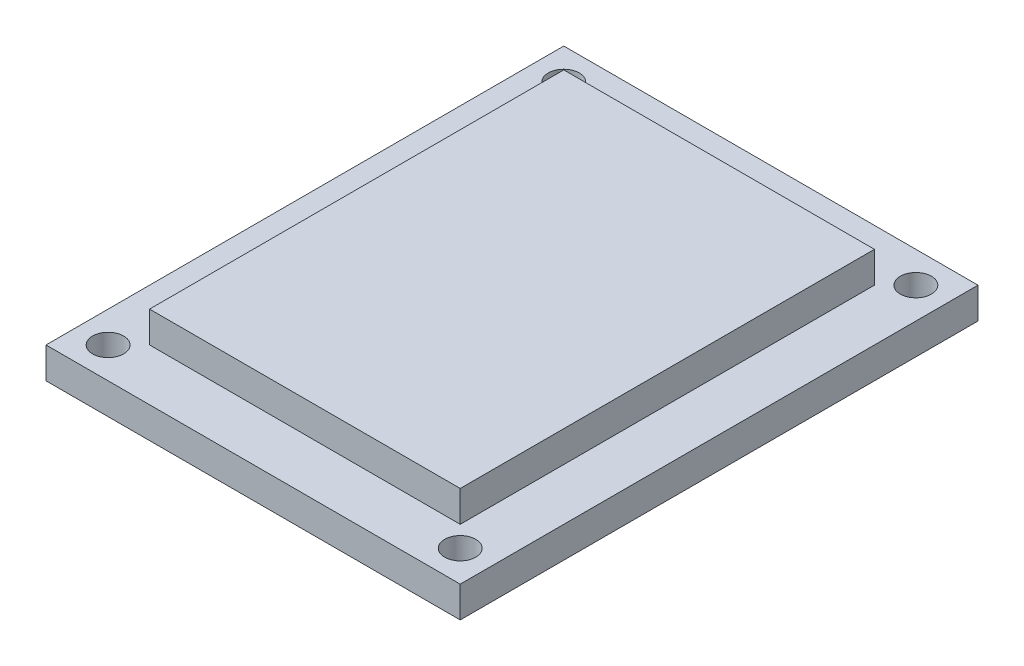
from build123d import *

# Parameters (mm, degrees)
SKETCH1_W           = 30
SKETCH1_H           = 40
BOSS_EXTRUDE1_DEPTH = 3
SKETCH2_W           = 40
SKETCH2_H           = 50
SKETCH2_R           = 1.5
BOSS_EXTRUDE2_DEPTH = 3


with BuildPart() as part:
    # Sketch1 → Boss-Extrude1 (new body)
    with BuildSketch(Plane(origin=(0, 0, 0), x_dir=(1, 0, 0), z_dir=(0, 1, 0))):
        Rectangle(SKETCH1_W, SKETCH1_H)
    extrude(amount=BOSS_EXTRUDE1_DEPTH)

    # Sketch2 → Boss-Extrude2 (add)
    with BuildSketch(Plane(origin=(0, 0, 0), x_dir=(1, 0, 0), z_dir=(0, 1, 0))):
        Rectangle(SKETCH2_W, SKETCH2_H)
        with Locations(Location((-17, 21.998038487, 0), (0, 0, 270))):
            Circle(SKETCH2_R, mode=Mode.SUBTRACT)
        with Locations(Location((17, 22, 0), (0, 0, 270))):
            Circle(SKETCH2_R, mode=Mode.SUBTRACT)
        with Locations(Location((17, -22, 0), (0, 0, 270))):
            Circle(SKETCH2_R, mode=Mode.SUBTRACT)
        with Locations(Location((-17, -22, 0), (0, 0, 270))):
            Circle(SKETCH2_R, mode=Mode.SUBTRACT)
    extrude(amount=-BOSS_EXTRUDE2_DEPTH)


solid = part.part
